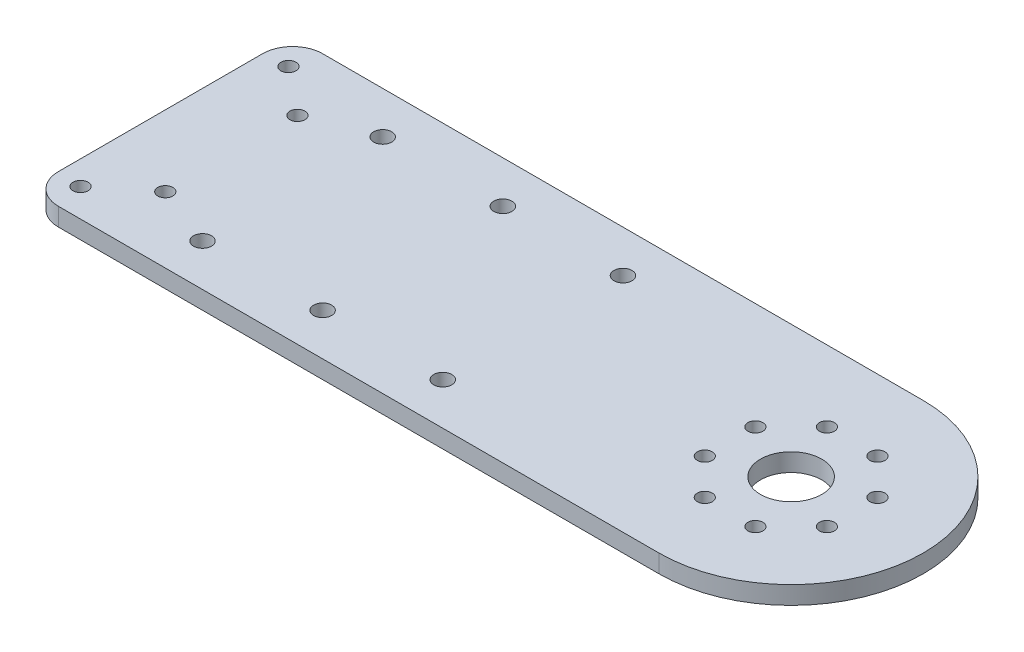
from build123d import *

# Parameters (mm, degrees)
SKETCH1_R           = 5.1
SKETCH1_R_2         = 1.25
BOSS_EXTRUDE1_DEPTH = 3
FILLET1_R           = 1.5
SKETCH3_R           = 1.5
CUT_EXTRUDE2_DEPTH  = 3
SKETCH4_W           = 33.045580095
SKETCH4_H           = 44
CUT_EXTRUDE3_DEPTH  = 10
FILLET2_R           = 5


with BuildPart() as part:
    # Sketch1 → Boss-Extrude1 (new body)
    with BuildSketch(Plane(origin=(0, 0, 0), x_dir=(1, 0, 0), z_dir=(0, 1, 0))):
        with BuildLine():
            Line((128, 22), (0, 22))
            Line((0, 22), (0, 16.492422502))
            ThreePointArc((0, 16.492422502), (8, 0), (0, -16.492422502))
            Line((0, -16.492422502), (0, -22))
            Line((0, -22), (128, -22))
            ThreePointArc((128, -22), (150, 0), (128, 22))
        make_face()
        with Locations(Location((128, 0, 0), (0, 0, 270))):
            Circle(SKETCH1_R, mode=Mode.SUBTRACT)
        with Locations(Location((117.837325142, 4.209517756, 0), (0, 0, 270))):
            Circle(SKETCH1_R_2, mode=Mode.SUBTRACT)
        with Locations(Location((123.790482244, 10.162674858, 0), (0, 0, 270))):
            Circle(SKETCH1_R_2, mode=Mode.SUBTRACT)
        with Locations(Location((132.209517756, 10.162674858, 0), (0, 0, 270))):
            Circle(SKETCH1_R_2, mode=Mode.SUBTRACT)
        with Locations(Location((138.162674858, 4.209517756, 0), (0, 0, 270))):
            Circle(SKETCH1_R_2, mode=Mode.SUBTRACT)
        with Locations(Location((138.162674858, -4.209517756, 0), (0, 0, 270))):
            Circle(SKETCH1_R_2, mode=Mode.SUBTRACT)
        with Locations(Location((132.209517756, -10.162674858, 0), (0, 0, 270))):
            Circle(SKETCH1_R_2, mode=Mode.SUBTRACT)
        with Locations(Location((5, 17.3, 0), (0, 0, 270))):
            Circle(SKETCH1_R_2, mode=Mode.SUBTRACT)
        with Locations(Location((27, 17.3, 0), (0, 0, 270))):
            Circle(SKETCH1_R_2, mode=Mode.SUBTRACT)
        with Locations(Location((27, -17.3, 0), (0, 0, 90))):
            Circle(SKETCH1_R_2, mode=Mode.SUBTRACT)
        with Locations(Location((5, -17.3, 0), (0, 0, 90))):
            Circle(SKETCH1_R_2, mode=Mode.SUBTRACT)
        with Locations(Location((123.790482244, -10.162674858, 0), (0, 0, 270))):
            Circle(SKETCH1_R_2, mode=Mode.SUBTRACT)
        with Locations(Location((117.837325142, -4.209517756, 0), (0, 0, 270))):
            Circle(SKETCH1_R_2, mode=Mode.SUBTRACT)
        with Locations(Location((34.8, 11, 0), (0, 0, 270))):
            Circle(SKETCH1_R_2, mode=Mode.SUBTRACT)
        with Locations(Location((34.8, -11, 0), (0, 0, 90))):
            Circle(SKETCH1_R_2, mode=Mode.SUBTRACT)
    extrude(amount=BOSS_EXTRUDE1_DEPTH)

    # Fillet1
    fillet1_edges = [part.edges().sort_by_distance(p)[0] for p in [
        (0, 1.5, 16.492422502),
        (0, 1.5, -16.492422502),
        (0, 1.5, -22),
        (0, 1.5, 22),
    ]]
    fillet(fillet1_edges, radius=FILLET1_R)

    # Sketch3 → Cut-Extrude2 (cut)
    with BuildSketch(Plane(origin=(0, 3, 0), x_dir=(1, 0, 0), z_dir=(0, 1, 0))):
        with Locations(Location((45, 15, 0), (0, 0, 270))):
            Circle(SKETCH3_R)
        with Locations(Location((65, 15, 0), (0, 0, 270))):
            Circle(SKETCH3_R)
        with Locations(Location((85, 15, 0), (0, 0, 270))):
            Circle(SKETCH3_R)
        with Locations(Location((85, -15, 0), (0, 0, 90))):
            Circle(SKETCH3_R)
        with Locations(Location((65, -15, 0), (0, 0, 90))):
            Circle(SKETCH3_R)
        with Locations(Location((45, -15, 0), (0, 0, 90))):
            Circle(SKETCH3_R)
    extrude(amount=-CUT_EXTRUDE2_DEPTH, mode=Mode.SUBTRACT)

    # Sketch4 → Cut-Extrude3 (cut)
    with BuildSketch(Plane.XZ):
        with Locations((6.477209952, 0)):
            Rectangle(SKETCH4_W, SKETCH4_H)
    extrude(amount=-CUT_EXTRUDE3_DEPTH, mode=Mode.SUBTRACT)

    # Fillet2
    fillet2_edges = [part.edges().sort_by_distance(p)[0] for p in [
        (23, 1.5, 22),
        (23, 1.5, -22),
    ]]
    fillet(fillet2_edges, radius=FILLET2_R)


solid = part.part
